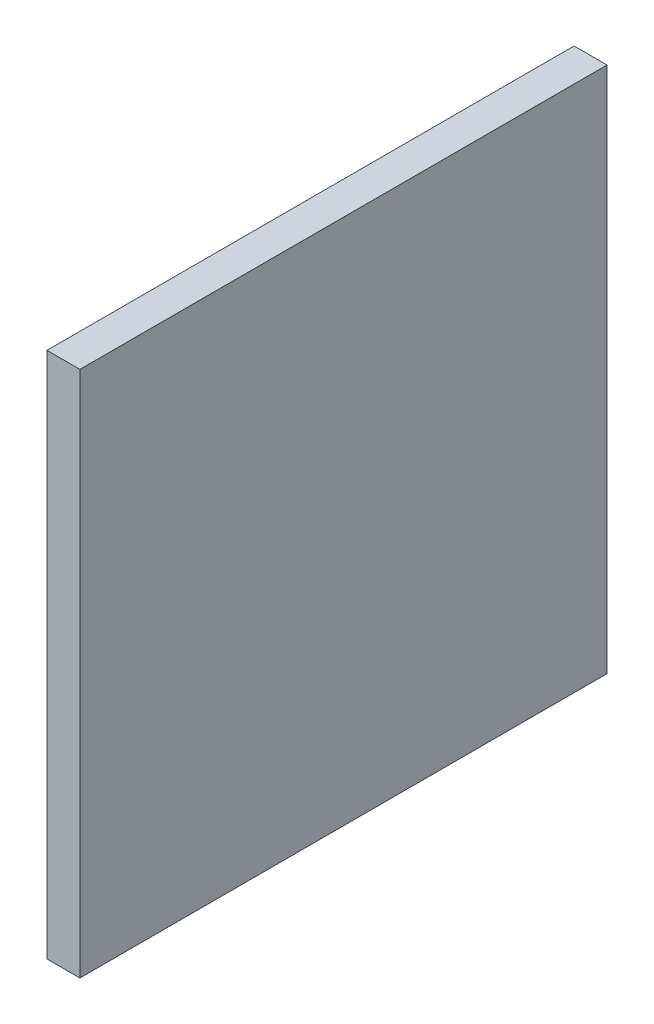
from build123d import *

# Parameters (mm, degrees)
SKETCH1_W           = 80
SKETCH1_H           = 80
BOSS_EXTRUDE1_DEPTH = 5


with BuildPart() as part:
    # Sketch1 → Boss-Extrude1 (new body)
    with BuildSketch(Plane(origin=(0, 0, 0), x_dir=(0, 0, -1), z_dir=(1, 0, 0))):
        with Locations((-40, 40)):
            Rectangle(SKETCH1_W, SKETCH1_H)
    extrude(amount=BOSS_EXTRUDE1_DEPTH)


solid = part.part
